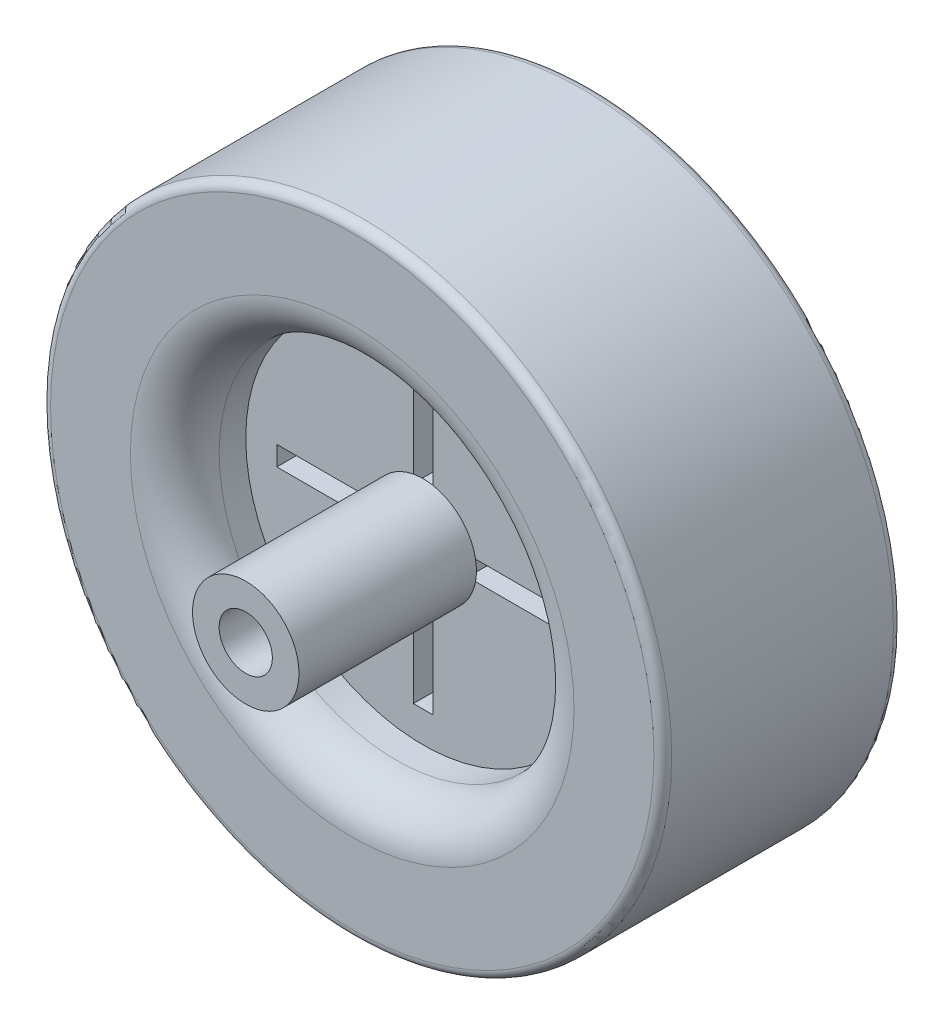
from build123d import *

# Parameters (mm, degrees)
SKETCH_1_R          = 35
EXTRUDE_1_DEPTH     = 27
SKETCH_2_R          = 20
CUT_EXTRUDE_1_DEPTH = 8
CUT_EXTRUDE_START   = -8
SKETCH_3_R          = 20
CUT_EXTRUDE_2_DEPTH = 8
FILLET_3_R          = 5
FILLET_4_R          = 5
SKETCH_4_R          = 6
EXTRUDE_2_DEPTH     = 20
SKETCH_5_R          = 3
CUT_EXTRUDE_3_DEPTH = 6
FILLET_5_R          = 1
FILLET_6_R          = 1
SKETCH_6_W          = 11.5
SKETCH_6_H          = 2.2
SKETCH_6_W_2        = 2.2
SKETCH_6_H_2        = 11.5
CUT_EXTRUDE_5_DEPTH = 11
SKETCH_7_R          = 2
EXTRUDE_3_DEPTH     = 4
FILLET_8_R          = 2


with BuildPart() as part:
    # 草图1 → 凸台-拉伸1 (new body)
    with BuildSketch(Plane.XY):
        Circle(SKETCH_1_R)
    extrude(amount=EXTRUDE_1_DEPTH)

    # 草图2 → 切除-拉伸1 (cut)
    with BuildSketch(Plane(origin=(0, 0, 0), x_dir=(-1, 0, 0), z_dir=(0, 0, -1))):
        Circle(SKETCH_2_R)
    extrude(amount=-CUT_EXTRUDE_1_DEPTH, mode=Mode.SUBTRACT)

    # 草图3 → 切除-拉伸2 (cut)
    with BuildSketch(Plane.XY.offset(27).offset(CUT_EXTRUDE_START)):
        with Locations(Location((0, 0, 0), (0, 0, 180))):
            Circle(SKETCH_3_R)
    extrude(amount=CUT_EXTRUDE_2_DEPTH, mode=Mode.SUBTRACT)

    # 圆角3
    fillet_3_edges = [part.edges().sort_by_distance(p)[0] for p in [
        (20, 0, 0),
    ]]
    fillet(fillet_3_edges, radius=FILLET_3_R)

    # 圆角4
    fillet_4_edges = [part.edges().sort_by_distance(p)[0] for p in [
        (20, 0, 27),
    ]]
    fillet(fillet_4_edges, radius=FILLET_4_R)

    # 草图4 → 凸台-拉伸2 (add)
    with BuildSketch(Plane.XY.offset(19)):
        Circle(SKETCH_4_R)
    extrude(amount=EXTRUDE_2_DEPTH)

    # 草图5 → 切除-拉伸3 (cut)
    with BuildSketch(Plane.XY.offset(39)):
        Circle(SKETCH_5_R)
    extrude(amount=-CUT_EXTRUDE_3_DEPTH, mode=Mode.SUBTRACT)

    # 圆角5
    fillet_5_edges = [part.edges().sort_by_distance(p)[0] for p in [
        (-35, 0, 0),
    ]]
    fillet(fillet_5_edges, radius=FILLET_5_R)

    # 圆角6
    fillet_6_edges = [part.edges().sort_by_distance(p)[0] for p in [
        (-35, 0, 27),
    ]]
    fillet(fillet_6_edges, radius=FILLET_6_R)

    # 草图6 → 切除-拉伸5 (cut)
    with BuildSketch(Plane(origin=(0, 0, 8), x_dir=(-1, 0, 0), z_dir=(0, 0, -1))):
        with Locations((10.75, 0)):
            Rectangle(SKETCH_6_W, SKETCH_6_H)
        with Locations((0, -10.75)):
            Rectangle(SKETCH_6_W_2, SKETCH_6_H_2)
        with Locations((0, 10.75)):
            Rectangle(SKETCH_6_W_2, SKETCH_6_H_2)
        with Locations((-10.75, 0)):
            Rectangle(SKETCH_6_W, SKETCH_6_H)
    extrude(amount=-CUT_EXTRUDE_5_DEPTH, mode=Mode.SUBTRACT)

    # 草图7 → 凸台-拉伸3 (add)
    with BuildSketch(Plane(origin=(0, 0, 8), x_dir=(-1, 0, 0), z_dir=(0, 0, -1))):
        Circle(SKETCH_7_R)
    extrude(amount=EXTRUDE_3_DEPTH)

    # 圆角8
    fillet_8_edges = [part.edges().sort_by_distance(p)[0] for p in [
        (2, 0, 4),
    ]]
    fillet(fillet_8_edges, radius=FILLET_8_R)


solid = part.part
